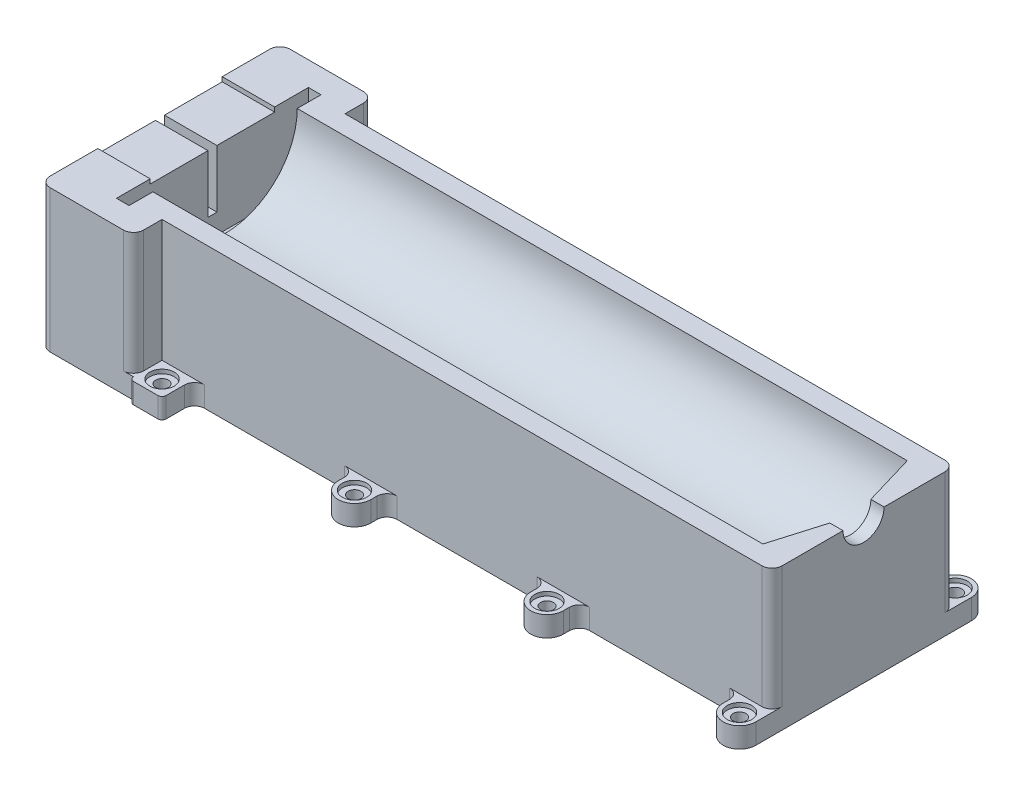
from build123d import *

# Parameters (mm, degrees)
SKETCH2_W           = 166
SKETCH2_H           = 45
BOSS_EXTRUDE1_DEPTH = 35
SKETCH3_W           = 150
SKETCH3_H           = 17.75
SKETCH3_W_2         = 3.25
SKETCH3_H_2         = 5.05
BOSS_EXTRUDE4_DEPTH = 35
SKETCH8_W           = 3.1
SKETCH8_H           = 47.2
CUT_EXTRUDE2_DEPTH  = 20.15
SKETCH9_W           = 2.2
SKETCH9_H           = 14.2
SKETCH9_W_2         = 14.2
SKETCH9_H_2         = 1.1
CUT_EXTRUDE4_DEPTH  = 20.15
SKETCH11_R          = 3
SKETCH11_R_2        = 1.575
SKETCH11_R_3        = 1.65
BOSS_EXTRUDE5_DEPTH = 5
SKETCH12_R          = 3
CUT_EXTRUDE6_DEPTH  = 1
FILLET1_R           = 2.5


with BuildPart() as part:
    # Sketch2 → Boss-Extrude1 (new body)
    with BuildSketch(Plane(origin=(0, 0, 0), x_dir=(1, 0, 0), z_dir=(0, 1, 0))):
        with Locations((-83, -22.5)):
            Rectangle(SKETCH2_W, SKETCH2_H)
    extrude(amount=BOSS_EXTRUDE1_DEPTH)

    # Sketch3 → Cut-Revolve1 (revolve, cut)
    with BuildSketch(Plane(origin=(0, 35, 0), x_dir=(1, 0, 0), z_dir=(0, 1, 0))):
        with Locations((-82, -13.625)):
            Rectangle(SKETCH3_W, SKETCH3_H)
        Polygon((-7, -22.5), (-7, -4.75), (-3.25, -17.45), (-3.25, -22.5), align=None)
        with Locations((-1.625, -19.975)):
            Rectangle(SKETCH3_W_2, SKETCH3_H_2)
    revolve(axis=Axis((-166, 35, 22.5), (1, 0, 0)), mode=Mode.SUBTRACT)

    # Sketch6 → Boss-Extrude4 (add)
    with BuildSketch(Plane.XZ):
        Polygon((-150, 45), (-150, 52), (-173, 52), (-173, -7), (-150, -7), (-150, 0), (-166, 0), (-166, 45), align=None)
    extrude(amount=-BOSS_EXTRUDE4_DEPTH)

    # Sketch8 → Cut-Extrude2 (cut)
    with BuildSketch(Plane(origin=(0, 35, 0), x_dir=(1, 0, 0), z_dir=(0, 1, 0))):
        with Locations((-158.55, -22.5)):
            Rectangle(SKETCH8_W, SKETCH8_H)
    extrude(amount=-CUT_EXTRUDE2_DEPTH, mode=Mode.SUBTRACT)

    # Sketch9 → Cut-Extrude4 (cut)
    with BuildSketch(Plane.ZY.offset(173)):
        with Locations((22.5, 43.2)):
            Rectangle(SKETCH9_W, SKETCH9_H)
        with Locations((14.3, 34.45)):
            Rectangle(SKETCH9_W_2, SKETCH9_H_2)
        with Locations((22.5, 34.45)):
            Rectangle(SKETCH9_W, SKETCH9_H_2)
        with Locations((30.7, 34.45)):
            Rectangle(SKETCH9_W_2, SKETCH9_H_2)
        with Locations((30.7, 35.55)):
            Rectangle(SKETCH9_W_2, SKETCH9_H_2)
        with Locations((14.3, 35.55)):
            Rectangle(SKETCH9_W_2, SKETCH9_H_2)
        with Locations((22.5, 35.55)):
            Rectangle(SKETCH9_W, SKETCH9_H_2)
        with Locations((22.5, 26.8)):
            Rectangle(SKETCH9_W, SKETCH9_H)
    extrude(amount=-CUT_EXTRUDE4_DEPTH, mode=Mode.SUBTRACT)

    # Sketch11 → Boss-Extrude5 (add)
    # profile 1 of 21: a face of its own
    with BuildSketch(Plane(origin=(0, 0, 0), x_dir=(-1, 0, 0), z_dir=(0, -1, 0))):
        with BuildLine():
            ThreePointArc((142, -52), (142.292893219, -52.707106781), (143, -53))
            Line((143, -53), (149, -53))
            ThreePointArc((149, -53), (149.707106781, -52.707106781), (150, -52))
            Line((150, -52), (150, -45))
            Line((150, -45), (142, -45))
            Line((142, -45), (142, -47.5))
            Line((142, -47.5), (142, -52))
        make_face()
        with Locations((146, -49)):
            Circle(SKETCH11_R, mode=Mode.SUBTRACT)
    # profile 2 of 21: a face of its own
    with BuildSketch(Plane(origin=(0, 0, 0), x_dir=(-1, 0, 0), z_dir=(0, -1, 0))):
        with Locations((146, -49)):
            Circle(SKETCH11_R)
        with Locations(Location((146, -49, 0), (0, 0, 90))):
            Circle(SKETCH11_R_2, mode=Mode.SUBTRACT)
    # profile 3 of 21: a face of its own
    with BuildSketch(Plane(origin=(0, 0, 0), x_dir=(-1, 0, 0), z_dir=(0, -1, 0))):
        with BuildLine():
            ThreePointArc((139.5, -45), (141.267766953, -45.732233047), (142, -47.5))
            Line((142, -47.5), (142, -45))
            Line((142, -45), (139.5, -45))
        make_face()
    # profile 4 of 21: a face of its own
    with BuildSketch(Plane(origin=(0, 0, 0), x_dir=(-1, 0, 0), z_dir=(0, -1, 0))):
        with BuildLine():
            ThreePointArc((102.666666667, -47.5), (103.398899714, -45.732233047), (105.166666667, -45))
            Line((105.166666667, -45), (102.666666667, -45))
            Line((102.666666667, -45), (102.666666667, -47.5))
        make_face()
    # profile 5 of 21: a face of its own
    with BuildSketch(Plane(origin=(0, 0, 0), x_dir=(-1, 0, 0), z_dir=(0, -1, 0))):
        with BuildLine():
            Line((102.666666667, -47.5), (102.666666667, -45))
            Line((102.666666667, -45), (94.666666667, -45))
            Line((94.666666667, -45), (94.666666667, -47.5))
            Line((94.666666667, -47.5), (94.666666667, -49))
            ThreePointArc((94.666666667, -49), (98.666666667, -53), (102.666666667, -49))
            Line((102.666666667, -49), (102.666666667, -47.5))
        make_face()
        with Locations(Location((98.666666667, -49, 0), (0, 0, 90))):
            Circle(SKETCH11_R_2, mode=Mode.SUBTRACT)
    # profile 6 of 21: a face of its own
    with BuildSketch(Plane(origin=(0, 0, 0), x_dir=(-1, 0, 0), z_dir=(0, -1, 0))):
        with BuildLine():
            Line((94.666666667, -47.5), (94.666666667, -45))
            Line((94.666666667, -45), (92.166666667, -45))
            ThreePointArc((92.166666667, -45), (93.93443362, -45.732233047), (94.666666667, -47.5))
        make_face()
    # profile 7 of 21: a face of its own
    with BuildSketch(Plane(origin=(0, 0, 0), x_dir=(-1, 0, 0), z_dir=(0, -1, 0))):
        with BuildLine():
            ThreePointArc((55.333333333, -47.5), (56.06556638, -45.732233047), (57.833333333, -45))
            Line((57.833333333, -45), (55.333333333, -45))
            Line((55.333333333, -45), (55.333333333, -47.5))
        make_face()
    # profile 8 of 21: a face of its own
    with BuildSketch(Plane(origin=(0, 0, 0), x_dir=(-1, 0, 0), z_dir=(0, -1, 0))):
        with BuildLine():
            Line((55.333333333, -47.5), (55.333333333, -45))
            Line((55.333333333, -45), (47.333333333, -45))
            Line((47.333333333, -45), (47.333333333, -47.5))
            Line((47.333333333, -47.5), (47.333333333, -49))
            ThreePointArc((47.333333333, -49), (51.333333333, -53), (55.333333333, -49))
            Line((55.333333333, -49), (55.333333333, -47.5))
        make_face()
        with Locations(Location((51.333333333, -49, 0), (0, 0, 90))):
            Circle(SKETCH11_R_2, mode=Mode.SUBTRACT)
    # profile 9 of 21: a face of its own
    with BuildSketch(Plane(origin=(0, 0, 0), x_dir=(-1, 0, 0), z_dir=(0, -1, 0))):
        with BuildLine():
            Line((47.333333333, -47.5), (47.333333333, -45))
            Line((47.333333333, -45), (44.833333333, -45))
            ThreePointArc((44.833333333, -45), (46.601100286, -45.732233047), (47.333333333, -47.5))
        make_face()
    # profile 10 of 21: a face of its own
    with BuildSketch(Plane(origin=(0, 0, 0), x_dir=(-1, 0, 0), z_dir=(0, -1, 0))):
        with BuildLine():
            ThreePointArc((8, -47.5), (8.732233047, -45.732233047), (10.5, -45))
            Line((10.5, -45), (8, -45))
            Line((8, -45), (8, -47.5))
        make_face()
    # profile 11 of 21: a face of its own
    with BuildSketch(Plane(origin=(0, 0, 0), x_dir=(-1, 0, 0), z_dir=(0, -1, 0))):
        with BuildLine():
            Line((8, -47.5), (8, -45))
            Line((8, -45), (0, -45))
            Line((0, -45), (0, -49))
            ThreePointArc((0, -49), (4, -53), (8, -49))
            Line((8, -49), (8, -47.5))
        make_face()
        with Locations(Location((4, -49, 0), (0, 0, 90))):
            Circle(SKETCH11_R_2, mode=Mode.SUBTRACT)
    # profile 12 of 21: a face of its own
    with BuildSketch(Plane(origin=(0, 0, 0), x_dir=(-1, 0, 0), z_dir=(0, -1, 0))):
        with BuildLine():
            Line((0, 0), (8, 0))
            Line((8, 0), (8, 2.499999984))
            Line((8, 2.499999984), (8, 4))
            ThreePointArc((8, 4), (4, 8), (0, 4))
            Line((0, 4), (0, 0))
        make_face()
        with Locations(Location((4, 4, 0), (0, 0, 90))):
            Circle(SKETCH11_R_3, mode=Mode.SUBTRACT)
    # profile 13 of 21: a face of its own
    with BuildSketch(Plane(origin=(0, 0, 0), x_dir=(-1, 0, 0), z_dir=(0, -1, 0))):
        with BuildLine():
            Line((8, 0), (10.500000012, 0))
            ThreePointArc((10.500000012, 0), (8.732233057, 0.732233037), (8, 2.499999984))
            Line((8, 2.499999984), (8, 0))
        make_face()
    # profile 14 of 21: a face of its own
    with BuildSketch(Plane(origin=(0, 0, 0), x_dir=(-1, 0, 0), z_dir=(0, -1, 0))):
        with BuildLine():
            Line((44.833333315, 0), (47.333333333, 0))
            Line((47.333333333, 0), (47.333333333, 2.5))
            ThreePointArc((47.333333333, 2.5), (46.60110028, 0.732233041), (44.833333315, 0))
        make_face()
    # profile 15 of 21: a face of its own
    with BuildSketch(Plane(origin=(0, 0, 0), x_dir=(-1, 0, 0), z_dir=(0, -1, 0))):
        with BuildLine():
            Line((47.333333333, 0), (55.333333333, 0))
            Line((55.333333333, 0), (55.333333333, 2.499999938))
            Line((55.333333333, 2.499999938), (55.333333333, 4))
            ThreePointArc((55.333333333, 4), (51.333333333, 8), (47.333333333, 4))
            Line((47.333333333, 4), (47.333333333, 2.5))
            Line((47.333333333, 2.5), (47.333333333, 0))
        make_face()
        with Locations(Location((51.333333333, 4, 0), (0, 0, 90))):
            Circle(SKETCH11_R_3, mode=Mode.SUBTRACT)
    # profile 16 of 21: a face of its own
    with BuildSketch(Plane(origin=(0, 0, 0), x_dir=(-1, 0, 0), z_dir=(0, -1, 0))):
        with BuildLine():
            Line((55.333333333, 0), (57.833333333, 0))
            ThreePointArc((57.833333333, 0), (56.065566402, 0.732233025), (55.333333333, 2.499999938))
            Line((55.333333333, 2.499999938), (55.333333333, 0))
        make_face()
    # profile 17 of 21: a face of its own
    with BuildSketch(Plane(origin=(0, 0, 0), x_dir=(-1, 0, 0), z_dir=(0, -1, 0))):
        with BuildLine():
            Line((92.166666667, 0), (94.666666667, 0))
            Line((94.666666667, 0), (94.666666667, 2.5))
            ThreePointArc((94.666666667, 2.5), (93.93443362, 0.732233047), (92.166666667, 0))
        make_face()
    # profile 18 of 21: a face of its own
    with BuildSketch(Plane(origin=(0, 0, 0), x_dir=(-1, 0, 0), z_dir=(0, -1, 0))):
        with BuildLine():
            Line((94.666666667, 0), (102.666666667, 0))
            Line((102.666666667, 0), (102.666666667, 2.499999973))
            Line((102.666666667, 2.499999973), (102.666666667, 4))
            ThreePointArc((102.666666667, 4), (98.666666667, 8), (94.666666667, 4))
            Line((94.666666667, 4), (94.666666667, 2.5))
            Line((94.666666667, 2.5), (94.666666667, 0))
        make_face()
        with Locations(Location((98.666666667, 4, 0), (0, 0, 90))):
            Circle(SKETCH11_R_3, mode=Mode.SUBTRACT)
    # profile 19 of 21: a face of its own
    with BuildSketch(Plane(origin=(0, 0, 0), x_dir=(-1, 0, 0), z_dir=(0, -1, 0))):
        with BuildLine():
            Line((102.666666667, 0), (105.166666667, 0))
            ThreePointArc((105.166666667, 0), (103.398899723, 0.732233038), (102.666666667, 2.499999973))
            Line((102.666666667, 2.499999973), (102.666666667, 0))
        make_face()
    # profile 20 of 21: a face of its own
    with BuildSketch(Plane(origin=(0, 0, 0), x_dir=(-1, 0, 0), z_dir=(0, -1, 0))):
        with BuildLine():
            Line((142, 0), (150, 0))
            Line((150, 0), (150, 7))
            ThreePointArc((150, 7), (149.707106781, 7.707106781), (149, 8))
            Line((149, 8), (143, 8))
            ThreePointArc((143, 8), (142.292893219, 7.707106781), (142, 7))
            Line((142, 7), (142, 2.5))
            Line((142, 2.5), (142, 0))
        make_face()
        with Locations(Location((146, 4, 0), (0, 0, 90))):
            Circle(SKETCH11_R_3, mode=Mode.SUBTRACT)
    # profile 21 of 21: a face of its own
    with BuildSketch(Plane(origin=(0, 0, 0), x_dir=(-1, 0, 0), z_dir=(0, -1, 0))):
        with BuildLine():
            Line((139.5, 0), (142, 0))
            Line((142, 0), (142, 2.5))
            ThreePointArc((142, 2.5), (141.267766953, 0.732233047), (139.5, 0))
        make_face()
    extrude(amount=-BOSS_EXTRUDE5_DEPTH)

    # Sketch12 → Cut-Extrude6 (cut)
    with BuildSketch(Plane(origin=(0, 5, 0), x_dir=(1, 0, 0), z_dir=(0, 1, 0))):
        with Locations(Location((-146, 4, 0), (0, 0, 270))):
            Circle(SKETCH12_R)
        with Locations(Location((-98.666666667, 4, 0), (0, 0, 270))):
            Circle(SKETCH12_R)
        with Locations(Location((-51.333333333, 4, 0), (0, 0, 270))):
            Circle(SKETCH12_R)
        with Locations(Location((-4, 4, 0), (0, 0, 270))):
            Circle(SKETCH12_R)
        with Locations(Location((-4, -49, 0), (0, 0, 270))):
            Circle(SKETCH12_R)
        with Locations(Location((-51.333333333, -49, 0), (0, 0, 270))):
            Circle(SKETCH12_R)
        with Locations(Location((-98.666666667, -49, 0), (0, 0, 270))):
            Circle(SKETCH12_R)
        with Locations(Location((-146, -49, 0), (0, 0, 270))):
            Circle(SKETCH12_R)
    extrude(amount=-CUT_EXTRUDE6_DEPTH, mode=Mode.SUBTRACT)

    # Fillet1
    fillet1_edges = [part.edges().sort_by_distance(p)[0] for p in [
        (-150, 20, -7),
        (-173, 17.5, -7),
        (-173, 17.5, 52),
        (-150, 20, 52),
        (0, 20, 45),
        (0, 20, 0),
    ]]
    fillet(fillet1_edges, radius=FILLET1_R)


solid = part.part
